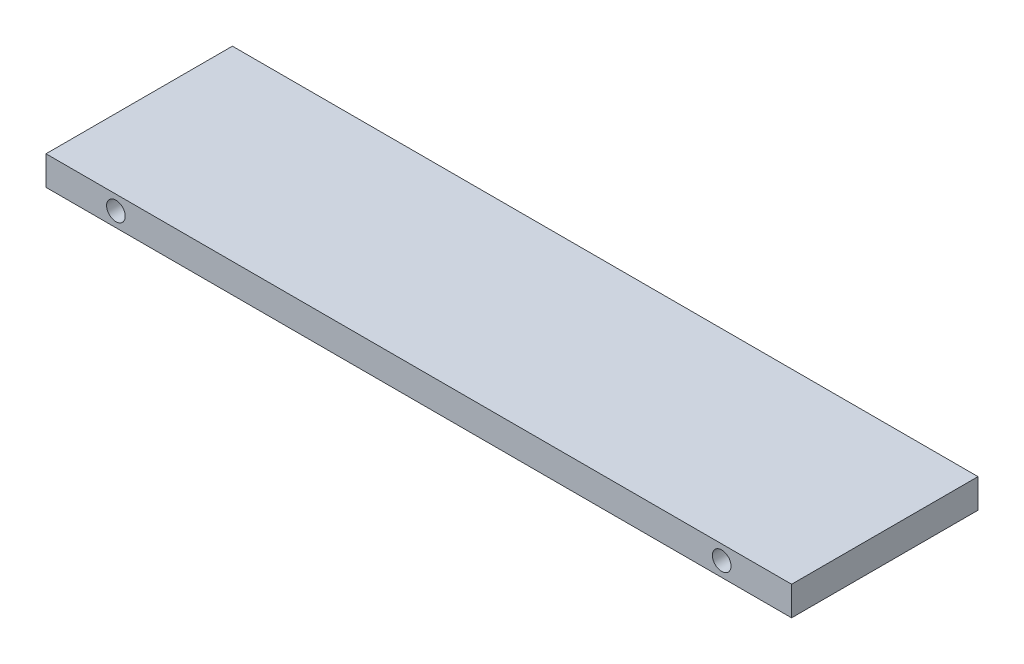
from build123d import *

# Parameters (mm, degrees)
REPLACEABLE_START                            = 42
SKETCH1_W                                    = 64
SKETCH1_H                                    = 2.5
SKETCH1_R                                    = 0.8
REPLACEABLE_ANGLED_RACK_REACTION_STRIP_DEPTH = 16


with BuildPart() as part:
    # Sketch1 → Replaceable angled-rack reaction strip (new body)
    with BuildSketch(Plane.XY.offset(REPLACEABLE_START)):
        with Locations((0, 45)):
            Rectangle(SKETCH1_W, SKETCH1_H)
        with Locations((-26, 45)):
            Circle(SKETCH1_R, mode=Mode.SUBTRACT)
        with Locations((26, 45)):
            Circle(SKETCH1_R, mode=Mode.SUBTRACT)
    extrude(amount=REPLACEABLE_ANGLED_RACK_REACTION_STRIP_DEPTH)


solid = part.part
